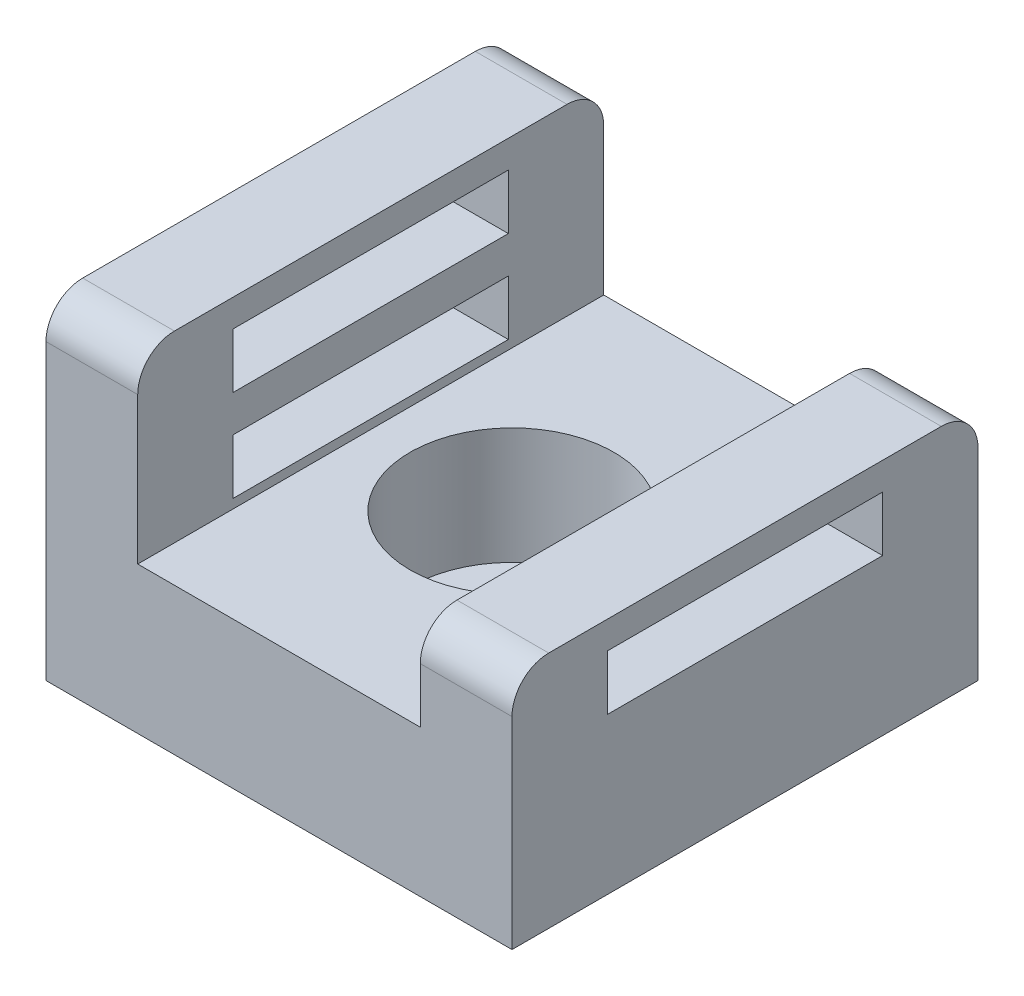
from build123d import *

# Parameters (mm, degrees)
SKETCH1_W                                        = 25.4
SKETCH1_H                                        = 25.4
BOSS_EXTRUDE1_DEPTH                              = 8
SKETCH2_W                                        = 5
SKETCH2_H                                        = 25.4
BOSS_EXTRUDE2_DEPTH                              = 5
CBORE_FOR_1_4_SOCKET_HEAD_CAP_SCREW1_D           = 6.7564
CBORE_FOR_1_4_SOCKET_HEAD_CAP_SCREW1_CBORE_D     = 11.1125
CBORE_FOR_1_4_SOCKET_HEAD_CAP_SCREW1_CBORE_DEPTH = 6.35
SKETCH5_W                                        = 15
SKETCH5_H                                        = 3
CUT_EXTRUDE1_DEPTH                               = 36.18983099
SKETCH6_W                                        = 5
SKETCH6_H                                        = 25.4
BOSS_EXTRUDE3_DEPTH                              = 5
SKETCH7_W                                        = 15
SKETCH7_H                                        = 3
CUT_EXTRUDE2_DEPTH                               = 38.327258205
FILLET1_R                                        = 2


with BuildPart() as part:
    # Sketch1 → Boss-Extrude1 (new body)
    with BuildSketch(Plane(origin=(0, 0, 0), x_dir=(1, 0, 0), z_dir=(0, 1, 0))):
        with Locations((2.028136882, -7.895247148)):
            Rectangle(SKETCH1_W, SKETCH1_H)
    extrude(amount=BOSS_EXTRUDE1_DEPTH)

    # Sketch2 → Boss-Extrude2 (add)
    with BuildSketch(Plane(origin=(0, 8, 0), x_dir=(1, 0, 0), z_dir=(0, 1, 0))):
        with Locations((-8.171863118, -7.895247148)):
            Rectangle(SKETCH2_W, SKETCH2_H)
        with Locations((12.228136882, -7.895247148)):
            Rectangle(SKETCH2_W, SKETCH2_H)
    extrude(amount=BOSS_EXTRUDE2_DEPTH)

    # CBORE for 1/4 Socket Head Cap Screw1 (through all)
    with Locations(Plane(origin=(0, 8, 0), x_dir=(1, 0, 0), z_dir=(0, 1, 0))):
        with Locations((22.31346114, -3.943712885), (2.028136882, -7.895247148)):
            CounterBoreHole(CBORE_FOR_1_4_SOCKET_HEAD_CAP_SCREW1_D / 2, CBORE_FOR_1_4_SOCKET_HEAD_CAP_SCREW1_CBORE_D / 2, CBORE_FOR_1_4_SOCKET_HEAD_CAP_SCREW1_CBORE_DEPTH)

    # Sketch5 → Cut-Extrude1 (cut, through all)
    with BuildSketch(Plane.ZY.offset(10.671863118)):
        with Locations((7.895247148, 10)):
            Rectangle(SKETCH5_W, SKETCH5_H)
    extrude(amount=-CUT_EXTRUDE1_DEPTH, mode=Mode.SUBTRACT)

    # Sketch6 → Boss-Extrude3 (add)
    with BuildSketch(Plane(origin=(0, 13, 0), x_dir=(1, 0, 0), z_dir=(0, 1, 0))):
        with Locations((-8.171863118, -7.895247148)):
            Rectangle(SKETCH6_W, SKETCH6_H)
    extrude(amount=BOSS_EXTRUDE3_DEPTH)

    # Sketch7 → Cut-Extrude2 (cut, through all)
    with BuildSketch(Plane.ZY.offset(10.671863118)):
        with Locations((7.895247148, 15)):
            Rectangle(SKETCH7_W, SKETCH7_H)
    extrude(amount=-CUT_EXTRUDE2_DEPTH, mode=Mode.SUBTRACT)

    # Fillet1
    fillet1_edges = [part.edges().sort_by_distance(p)[0] for p in [
        (12.228136882, 13, -4.804752852),
        (12.228136882, 13, 20.595247148),
        (-8.171863118, 18, -4.804752852),
        (-8.171863118, 18, 20.595247148),
    ]]
    fillet(fillet1_edges, radius=FILLET1_R)


solid = part.part
